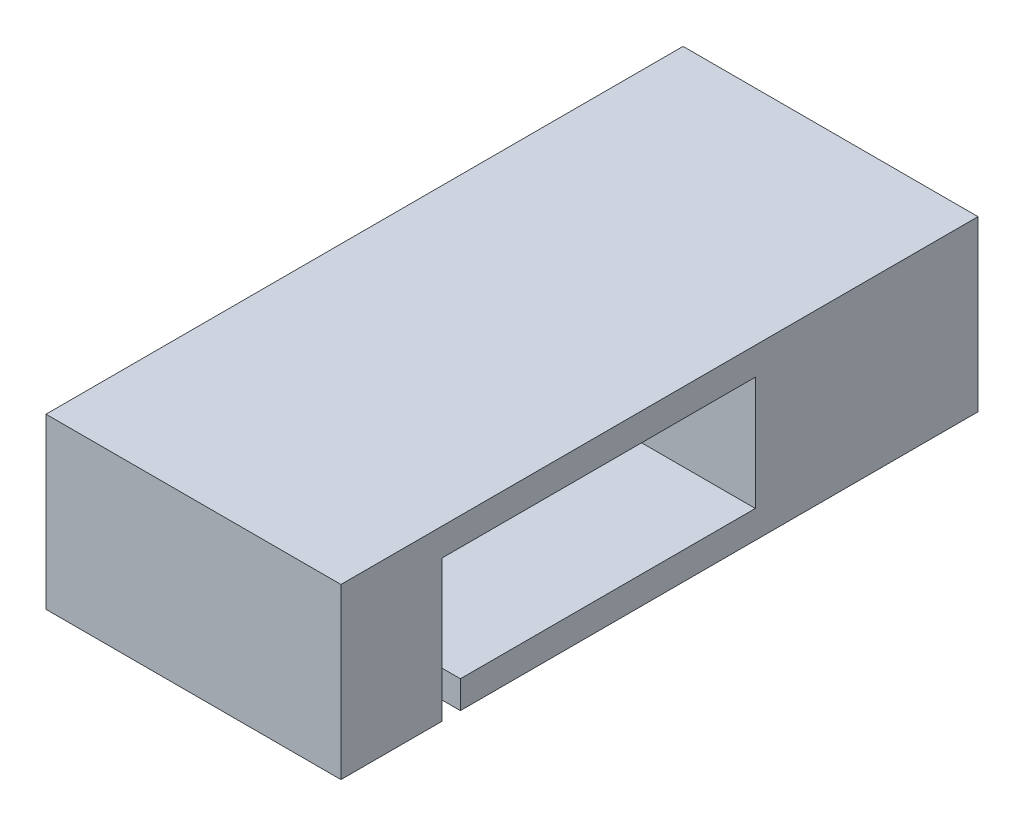
from build123d import *

# Parameters (mm, degrees)
SKETCH2_W           = 32
SKETCH2_H           = 69.12
BOSS_EXTRUDE1_DEPTH = 18.34
CUT_EXTRUDE1_DEPTH  = 29
SKETCH4_R           = 2.305
BOSS_EXTRUDE3_DEPTH = 6


with BuildPart() as part:
    # Sketch2 → Boss-Extrude1 (new body)
    with BuildSketch(Plane(origin=(0, 0, 0), x_dir=(1, 0, 0), z_dir=(0, 1, 0))):
        Rectangle(SKETCH2_W, SKETCH2_H)
    extrude(amount=BOSS_EXTRUDE1_DEPTH)

    # Sketch3 → Cut-Extrude1 (cut)
    with BuildSketch(Plane(origin=(16, 0, 0), x_dir=(0, 0, -1), z_dir=(1, 0, 0))):
        Polygon((-23.6, 15.34), (10.4, 15.34), (10.4, 3), (-21.6, 3), (-21.6, 0), (-23.6, 0), (-23.6, 3), align=None)
    extrude(amount=-CUT_EXTRUDE1_DEPTH, mode=Mode.SUBTRACT)

    # Sketch4 → Boss-Extrude3 (add)
    with BuildSketch(Plane.ZY.offset(16)):
        with Locations(Location((0, 9.17, 0), (0, 0, 180))):
            Circle(SKETCH4_R)
    extrude(amount=BOSS_EXTRUDE3_DEPTH)


solid = part.part
